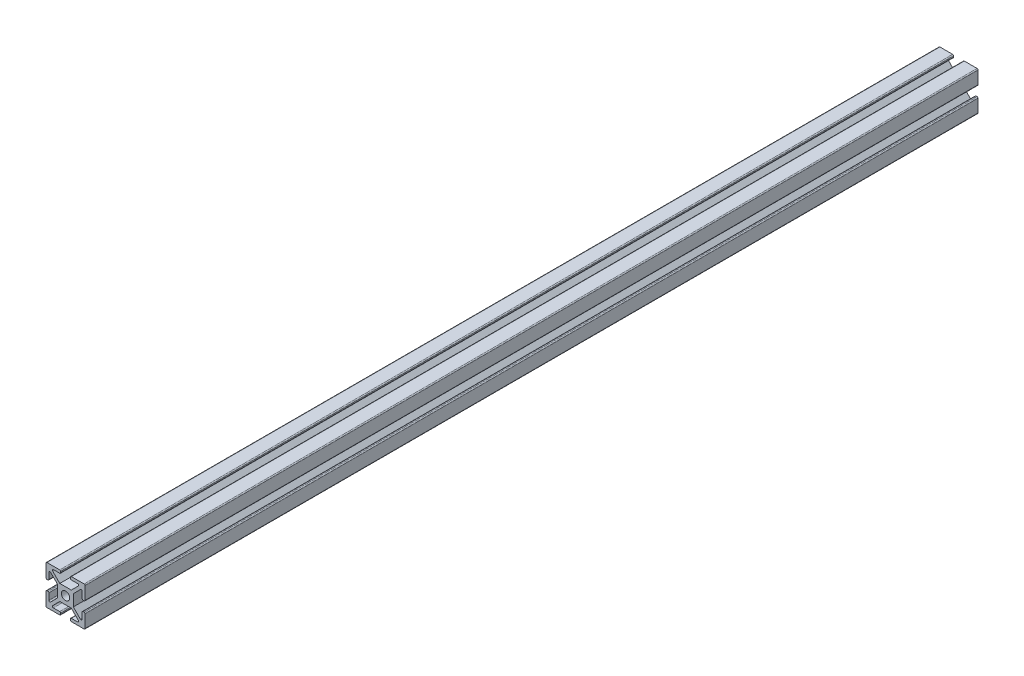
from build123d import *

# Parameters (mm, degrees)
SKETCH1_R           = 2.15
BOSS_EXTRUDE1_DEPTH = 457.2
FILLET1_R           = 0.5


with BuildPart() as part:
    # Sketch1 → Boss-Extrude1 (new body)
    with BuildSketch(Plane.XY):
        Polygon((-10, 2.5), (-8.5, 2.5), (-8.5, 7.439339828), (-4, 2.939339828), (-4, 0), (-4, -2.939339828), (-8.5, -7.439339828), (-8.5, -2.5), (-10, -2.5), (-10, -10), (-2.5, -10), (-2.5, -8.5), (-7.439339828, -8.5), (-2.939339828, -4), (0, -4), (2.939339828, -4), (7.439339828, -8.5), (2.5, -8.5), (2.5, -10), (10, -10), (10, -2.5), (8.5, -2.5), (8.5, -7.439339828), (4, -2.939339828), (4, 0), (4, 2.939339828), (8.5, 7.439339828), (8.5, 2.5), (10, 2.5), (10, 10), (2.5, 10), (2.5, 8.5), (7.439339828, 8.5), (2.939339828, 4), (0, 4), (-2.939339828, 4), (-7.439339828, 8.5), (-2.5, 8.5), (-2.5, 10), (-10, 10), align=None)
        Circle(SKETCH1_R, mode=Mode.SUBTRACT)
    extrude(amount=BOSS_EXTRUDE1_DEPTH)

    # Fillet1
    fillet1_edges = [part.edges().sort_by_distance(p)[0] for p in [
        (7.439339828, 8.5, 228.6),
        (2.5, 8.5, 228.6),
        (2.5, 10, 228.6),
        (10, 10, 228.6),
        (10, 2.5, 228.6),
        (8.5, 2.5, 228.6),
        (8.5, 7.439339828, 228.6),
        (8.5, -7.439339828, 228.6),
        (8.5, -2.5, 228.6),
        (10, -2.5, 228.6),
        (10, -10, 228.6),
        (2.5, -10, 228.6),
        (2.5, -8.5, 228.6),
        (7.439339828, -8.5, 228.6),
        (-7.439339828, -8.5, 228.6),
        (-2.5, -8.5, 228.6),
        (-2.5, -10, 228.6),
        (-10, -10, 228.6),
        (-10, -2.5, 228.6),
        (-8.5, -2.5, 228.6),
        (-8.5, -7.439339828, 228.6),
        (-8.5, 7.439339828, 228.6),
        (-8.5, 2.5, 228.6),
        (-10, 2.5, 228.6),
        (-10, 10, 228.6),
        (-2.5, 10, 228.6),
        (-2.5, 8.5, 228.6),
        (-7.439339828, 8.5, 228.6),
    ]]
    fillet(fillet1_edges, radius=FILLET1_R)


solid = part.part
